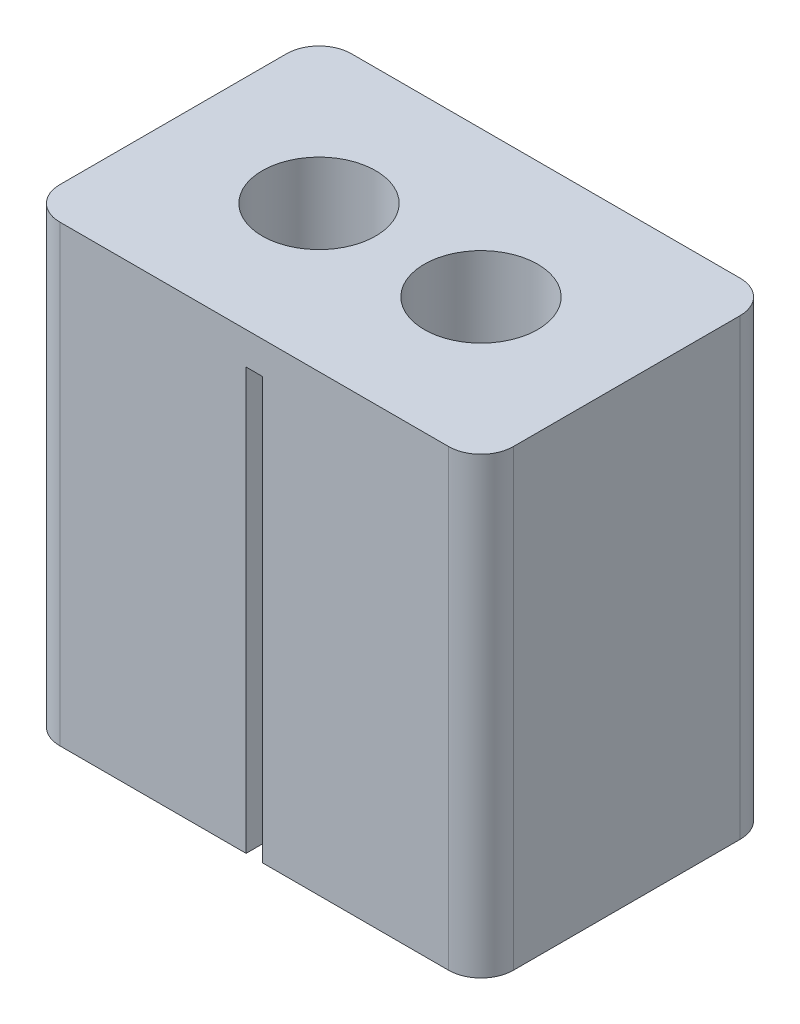
from build123d import *

# Parameters (mm, degrees)
SKETCH_1_W          = 14
SKETCH_1_H          = 9
EXTRUDE_1_DEPTH     = 14
FILLET_1_R          = 1
SKETCH_3_R          = 1.75
CUT_EXTRUDE_2_DEPTH = 7
CUT_EXTRUDE_3_REACH = 12.874
SKETCH_4_R          = 0.95
CUT_EXTRUDE_START   = -14
SKETCH_6_W          = 0.5
SKETCH_6_H          = 9
CUT_EXTRUDE_4_DEPTH = 13


with BuildPart() as part:
    # 草图1 → 凸台-拉伸1 (new body)
    with BuildSketch(Plane(origin=(0, 0, 0), x_dir=(1, 0, 0), z_dir=(0, 1, 0))):
        Rectangle(SKETCH_1_W, SKETCH_1_H)
    extrude(amount=EXTRUDE_1_DEPTH)

    # 圆角1
    fillet_1_edges = [part.edges().sort_by_distance(p)[0] for p in [
        (7, 7, 4.5),
        (-7, 7, 4.5),
        (-7, 7, -4.5),
        (7, 7, -4.5),
    ]]
    fillet(fillet_1_edges, radius=FILLET_1_R)

    # 草图3 → 切除-拉伸2 (cut)
    with BuildSketch(Plane(origin=(0, 14, 0), x_dir=(1, 0, 0), z_dir=(0, 1, 0))):
        with Locations(Location((-2.5, 0, 0), (0, 0, 270))):
            Circle(SKETCH_3_R)
        with Locations(Location((2.5, 0, 0), (0, 0, 90))):
            Circle(SKETCH_3_R)
    extrude(amount=-CUT_EXTRUDE_2_DEPTH, mode=Mode.SUBTRACT)

    # 草图4 → 切除-拉伸3 (cut, up to next)
    with BuildSketch(Plane(origin=(0, 7, 0), x_dir=(1, 0, 0), z_dir=(0, 1, 0)), mode=Mode.PRIVATE) as cut_extrude_3_sk1:
        with Locations(Location((-2.5, 0, 0), (0, 0, 270))):
            Circle(SKETCH_4_R)
    cut_extrude_3_tool1 = extrude(cut_extrude_3_sk1.sketch, amount=-CUT_EXTRUDE_3_REACH, mode=Mode.PRIVATE) & part.part
    # 草图4 → 切除-拉伸3 (cut, up to next)
    with BuildSketch(Plane(origin=(0, 7, 0), x_dir=(1, 0, 0), z_dir=(0, 1, 0)), mode=Mode.PRIVATE) as cut_extrude_3_sk2:
        with Locations(Location((2.5, 0, 0), (0, 0, 270))):
            Circle(SKETCH_4_R)
    cut_extrude_3_tool2 = extrude(cut_extrude_3_sk2.sketch, amount=-CUT_EXTRUDE_3_REACH, mode=Mode.PRIVATE) & part.part
    add(cut_extrude_3_tool1.solids().sort_by_distance((-2.5, 7, 0))[0], mode=Mode.SUBTRACT)
    add(cut_extrude_3_tool2.solids().sort_by_distance((2.5, 7, 0))[0], mode=Mode.SUBTRACT)

    # 草图6 → 切除-拉伸4 (cut)
    with BuildSketch(Plane(origin=(0, 14, 0), x_dir=(1, 0, 0), z_dir=(0, 1, 0)).offset(CUT_EXTRUDE_START)):
        Rectangle(SKETCH_6_W, SKETCH_6_H)
    extrude(amount=CUT_EXTRUDE_4_DEPTH, mode=Mode.SUBTRACT)


solid = part.part
